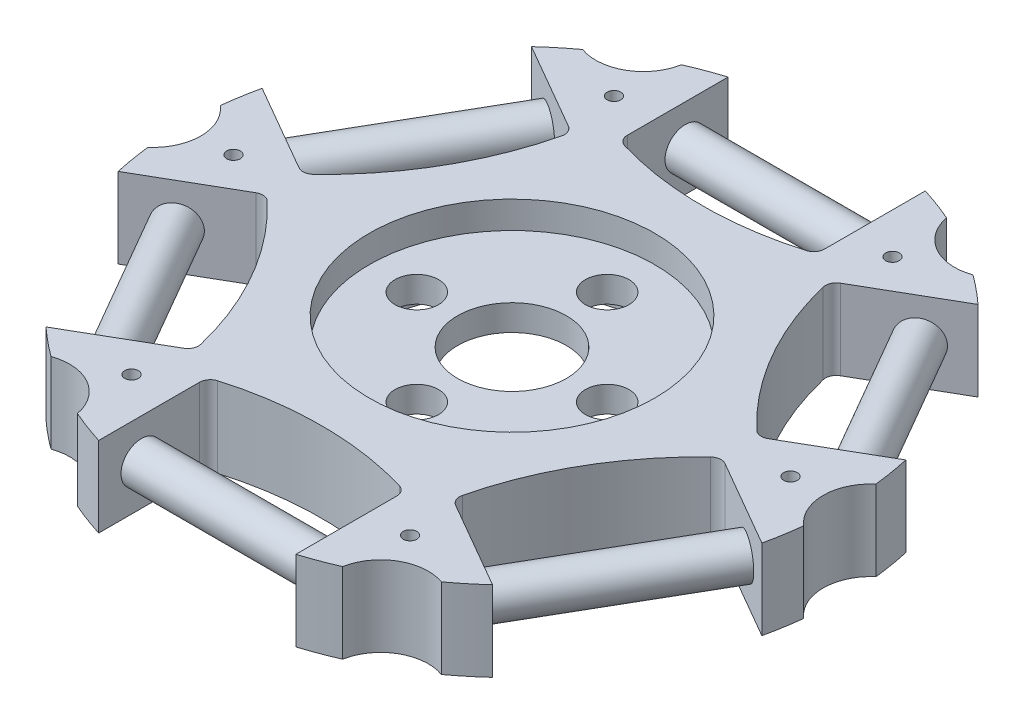
from build123d import *

# Parameters (mm, degrees)
SKETCH_1_W                  = 24.25
SKETCH_1_H                  = 5.9
CUT_EXTRUDE_1_DEPTH         = 35.798491347
CUT_EXTRUDE_2_DEPTH         = 35.798491347
CUT_EXTRUDE_3_DEPTH         = 35.798491347
CUT_EXTRUDE_4_DEPTH         = 35.798491347
CUT_EXTRUDE_5_DEPTH         = 35.798491347
CUT_EXTRUDE_6_DEPTH         = 35.798491347
CUT_EXTRUDE_7_DEPTH         = 35.798491347
CUT_EXTRUDE_8_DEPTH         = 35.034871823
CUT_EXTRUDE_9_DEPTH         = 35.034871823
CUT_EXTRUDE_10_DEPTH        = 35.034871823
CUT_EXTRUDE_11_DEPTH        = 34.930864282
CUT_EXTRUDE_12_DEPTH        = 34.930864282
SKETCH_15_W                 = 14.5
SKETCH_15_H                 = 1.5
HOLE_WIZARD_3_2_3_2_1_D     = 3.2
HOLE_WIZARD_3_2_3_2_1_DEPTH = 3.9
FILLET_1_R                  = 0.8
SKETCH_23_R                 = 0.5
CUT_EXTRUDE_13_DEPTH        = 10
PATTERN_CIRCULAR_1_COUNT    = 6
PATTERN_CIRCULAR_2_COUNT    = 6


with BuildPart() as part:
    # 草图1 → 旋转1 (revolve)
    with BuildSketch(Plane(origin=(0, 0, 0), x_dir=(-1, 0, 0), z_dir=(0, 0, -1)), mode=Mode.PRIVATE) as revolve_1_sk:
        with Locations((-12.125, -0.05)):
            Rectangle(SKETCH_1_W, SKETCH_1_H)
    revolve(revolve_1_sk.sketch.rotate(Axis((0, -3, 0), (0, 1, 0)), 270), axis=Axis((0, -3, 0), (0, 1, 0)))

    # 草图2 → 切除-拉伸1 (cut, through all)
    with BuildSketch(Plane(origin=(0, 2.9, 0), x_dir=(-1, 0, 0), z_dir=(0, 1, 0))):
        with BuildLine():
            Line((-7.25, 23.140872931), (-7.25, 15.140872931))
            ThreePointArc((-7.25, 15.140872931), (0, 14), (7.25, 15.140872931))
            Line((7.25, 15.140872931), (7.25, 23.140872931))
            ThreePointArc((7.25, 23.140872931), (0, 24.25), (-7.25, 23.140872931))
        make_face()
    extrude(amount=-CUT_EXTRUDE_1_DEPTH, mode=Mode.SUBTRACT)

    # 草图3 → 切除-拉伸2 (cut, through all)
    with BuildSketch(Plane(origin=(0, 2.9, 0), x_dir=(-1, 0, 0), z_dir=(0, 1, 0))):
        with BuildLine():
            ThreePointArc((14.354448547, 19.545135121), (12.125, 21.001116042), (9.749359262, 22.20388466))
            ThreePointArc((9.749359262, 22.20388466), (11.44, 19.814661239), (14.354448547, 19.545135121))
        make_face()
    extrude(amount=-CUT_EXTRUDE_2_DEPTH, mode=Mode.SUBTRACT)

    # 草图4 → 切除-拉伸3 (cut, through all)
    with BuildSketch(Plane(origin=(0, 2.9, 0), x_dir=(-1, 0, 0), z_dir=(0, 1, 0))):
        with BuildLine():
            Line((16.415583824, 17.849120643), (9.487380594, 13.849120643))
            ThreePointArc((9.487380594, 13.849120643), (12.124355653, 7), (16.737380594, 1.291752288))
            Line((16.737380594, 1.291752288), (23.665583824, 5.291752288))
            ThreePointArc((23.665583824, 5.291752288), (21.001116042, 12.125), (16.415583824, 17.849120643))
        make_face()
    extrude(amount=-CUT_EXTRUDE_3_DEPTH, mode=Mode.SUBTRACT)

    # 草图5 → 切除-拉伸4 (cut, through all)
    with BuildSketch(Plane(origin=(0, 2.9, 0), x_dir=(-1, 0, 0), z_dir=(0, 1, 0))):
        with BuildLine():
            ThreePointArc((24.103807809, -2.658749539), (24.25, 0), (24.103807809, 2.658749539))
            ThreePointArc((24.103807809, 2.658749539), (22.88, 0), (24.103807809, -2.658749539))
        make_face()
    extrude(amount=-CUT_EXTRUDE_4_DEPTH, mode=Mode.SUBTRACT)

    # 草图6 → 切除-拉伸5 (cut, through all)
    with BuildSketch(Plane(origin=(0, 2.9, 0), x_dir=(-1, 0, 0), z_dir=(0, 1, 0))):
        with BuildLine():
            Line((23.665583824, -5.291752288), (16.737380594, -1.291752288))
            ThreePointArc((16.737380594, -1.291752288), (12.124355653, -7), (9.487380594, -13.849120643))
            Line((9.487380594, -13.849120643), (16.415583824, -17.849120643))
            ThreePointArc((16.415583824, -17.849120643), (21.001116042, -12.125), (23.665583824, -5.291752288))
        make_face()
    extrude(amount=-CUT_EXTRUDE_5_DEPTH, mode=Mode.SUBTRACT)

    # 草图7 → 切除-拉伸6 (cut, through all)
    with BuildSketch(Plane(origin=(0, 2.9, 0), x_dir=(-1, 0, 0), z_dir=(0, 1, 0))):
        with BuildLine():
            ThreePointArc((9.749359262, -22.20388466), (12.125, -21.001116042), (14.354448547, -19.545135121))
            ThreePointArc((14.354448547, -19.545135121), (11.44, -19.814661239), (9.749359262, -22.20388466))
        make_face()
    extrude(amount=-CUT_EXTRUDE_6_DEPTH, mode=Mode.SUBTRACT)

    # 草图8 → 切除-拉伸7 (cut, through all)
    with BuildSketch(Plane(origin=(0, 2.9, 0), x_dir=(-1, 0, 0), z_dir=(0, 1, 0))):
        with BuildLine():
            Line((7.25, -23.140872931), (7.25, -15.140872931))
            ThreePointArc((7.25, -15.140872931), (0, -14), (-7.25, -15.140872931))
            Line((-7.25, -15.140872931), (-7.25, -23.140872931))
            ThreePointArc((-7.25, -23.140872931), (0, -24.25), (7.25, -23.140872931))
        make_face()
    extrude(amount=-CUT_EXTRUDE_7_DEPTH, mode=Mode.SUBTRACT)

    # 草图9 → 切除-拉伸8 (cut, through all)
    with BuildSketch(Plane(origin=(0, 2.9, 0), x_dir=(-1, 0, 0), z_dir=(0, 1, 0))):
        with BuildLine():
            ThreePointArc((-14.354448547, -19.545135121), (-12.125, -21.001116042), (-9.749359262, -22.20388466))
            ThreePointArc((-9.749359262, -22.20388466), (-11.44, -19.814661239), (-14.354448547, -19.545135121))
        make_face()
    extrude(amount=-CUT_EXTRUDE_8_DEPTH, mode=Mode.SUBTRACT)

    # 草图10 → 切除-拉伸9 (cut, through all)
    with BuildSketch(Plane(origin=(0, 2.9, 0), x_dir=(-1, 0, 0), z_dir=(0, 1, 0))):
        with BuildLine():
            Line((-16.415583824, -17.849120643), (-9.487380594, -13.849120643))
            ThreePointArc((-9.487380594, -13.849120643), (-12.124355653, -7), (-16.737380594, -1.291752288))
            Line((-16.737380594, -1.291752288), (-23.665583824, -5.291752288))
            ThreePointArc((-23.665583824, -5.291752288), (-21.001116042, -12.125), (-16.415583824, -17.849120643))
        make_face()
    extrude(amount=-CUT_EXTRUDE_9_DEPTH, mode=Mode.SUBTRACT)

    # 草图11 → 切除-拉伸10 (cut, through all)
    with BuildSketch(Plane(origin=(0, 2.9, 0), x_dir=(-1, 0, 0), z_dir=(0, 1, 0))):
        with BuildLine():
            ThreePointArc((-24.103807809, 2.658749539), (-24.25, 0), (-24.103807809, -2.658749539))
            ThreePointArc((-24.103807809, -2.658749539), (-22.88, 0), (-24.103807809, 2.658749539))
        make_face()
    extrude(amount=-CUT_EXTRUDE_10_DEPTH, mode=Mode.SUBTRACT)

    # 草图12 → 切除-拉伸11 (cut, through all)
    with BuildSketch(Plane(origin=(0, 2.9, 0), x_dir=(-1, 0, 0), z_dir=(0, 1, 0))):
        with BuildLine():
            Line((-23.665583824, 5.291752288), (-16.737380594, 1.291752288))
            ThreePointArc((-16.737380594, 1.291752288), (-12.124355653, 7), (-9.487380594, 13.849120643))
            Line((-9.487380594, 13.849120643), (-16.415583824, 17.849120643))
            ThreePointArc((-16.415583824, 17.849120643), (-21.001116042, 12.125), (-23.665583824, 5.291752288))
        make_face()
    extrude(amount=-CUT_EXTRUDE_11_DEPTH, mode=Mode.SUBTRACT)

    # 草图13 → 切除-拉伸12 (cut, through all)
    with BuildSketch(Plane(origin=(0, 2.9, 0), x_dir=(-1, 0, 0), z_dir=(0, 1, 0))):
        with BuildLine():
            ThreePointArc((-9.749359262, 22.20388466), (-12.125, 21.001116042), (-14.354448547, 19.545135121))
            ThreePointArc((-14.354448547, 19.545135121), (-11.44, 19.814661239), (-9.749359262, 22.20388466))
        make_face()
    extrude(amount=-CUT_EXTRUDE_12_DEPTH, mode=Mode.SUBTRACT)

    # 草图14 → 切除-旋转1 (revolve, cut)
    with BuildSketch(Plane.XY):
        Polygon((10.5, 2.9), (0, 2.9), (0, -3), (10.5, -3), (10.5, -1), (4, -1), (4, 0.9), (10.5, 0.9), align=None)
    revolve(axis=Axis((0, 2.9, 0), (0, -1, 0)), mode=Mode.SUBTRACT)

    # 草图15 → 旋转2 (revolve)
    with BuildSketch(Plane(origin=(0, 0, 20), x_dir=(-1, 0, 0), z_dir=(0, 0, -1)), mode=Mode.PRIVATE) as revolve_2_sk:
        with Locations((0, 0.7)):
            Rectangle(SKETCH_15_W, SKETCH_15_H)
    revolve_2 = revolve(revolve_2_sk.sketch.rotate(Axis((7.25, -0.05, 20), (-1, 0, 0)), 270), axis=Axis((7.25, -0.05, 20), (-1, 0, 0)))

    # Ø3.2 (3.2) 直径孔1
    with Locations(Plane(origin=(0, -1, 0), x_dir=(-1, 0, 0), z_dir=(0, -1, 0))):
        with Locations((0, 7), (0, -7), (-7, 0), (7, 0)):
            Hole(HOLE_WIZARD_3_2_3_2_1_D / 2, depth=HOLE_WIZARD_3_2_3_2_1_DEPTH)

    # 圆角1
    fillet_1_edges = [part.edges().sort_by_distance(p)[0] for p in [
        (16.737380594, -0.05, -1.291752288),
        (9.487380594, -0.05, -13.849120643),
        (-7.25, -0.05, 15.140872931),
        (7.25, -0.05, 15.140872931),
        (9.487380594, -0.05, 13.849120643),
        (16.737380594, -0.05, 1.291752288),
        (-16.737380594, -0.05, 1.291752288),
        (-9.487380594, -0.05, 13.849120643),
        (-9.487380594, -0.05, -13.849120643),
        (-16.737380594, -0.05, -1.291752288),
        (7.25, -0.05, -15.140872931),
        (-7.25, -0.05, -15.140872931),
    ]]
    fillet(fillet_1_edges, radius=FILLET_1_R)

    # 草图23 → 切除-拉伸13 (cut)
    with BuildSketch(Plane.XZ.offset(3)):
        with Locations(Location((20.48, 0, 0), (0, 0, 270))):
            Circle(SKETCH_23_R)
    cut_extrude_13 = extrude(amount=-CUT_EXTRUDE_13_DEPTH, mode=Mode.SUBTRACT)

    # 阵列(圆周)1: 切除-拉伸13 ×6 about axis
    pattern_circular_1_axis = Axis((0, 0, 0), (0, 1, 0))
    for i in range(1, PATTERN_CIRCULAR_1_COUNT):
        add(cut_extrude_13.rotate(pattern_circular_1_axis, i * 360 / PATTERN_CIRCULAR_1_COUNT), mode=Mode.SUBTRACT)

    # 阵列(圆周)2: 旋转2 ×6 about axis
    pattern_circular_2_axis = Axis((0, 2.9, 0), (0, -1, 0))
    for i in range(1, PATTERN_CIRCULAR_2_COUNT):
        add(revolve_2.rotate(pattern_circular_2_axis, i * 360 / PATTERN_CIRCULAR_2_COUNT))


solid = part.part
